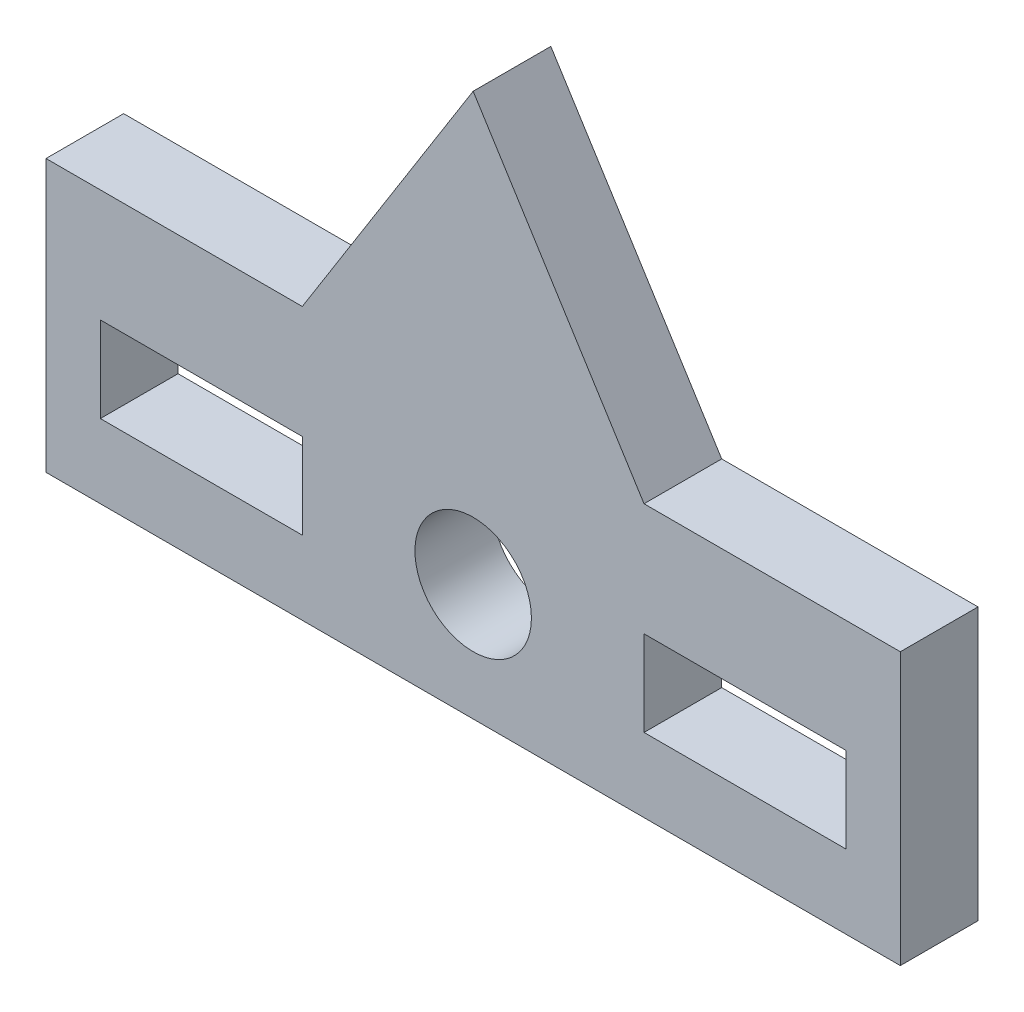
from build123d import *

# Parameters (mm, degrees)
SKETCH_1_R      = 1.5
SKETCH_1_W      = 5.2
SKETCH_1_H      = 2.2
EXTRUDE_1_DEPTH = 2


with BuildPart() as part:
    # 草图1 → 凸台-拉伸1 (new body)
    with BuildSketch(Plane.XY):
        Polygon((-11, 0), (-11, -3), (11, -3), (11, 0), (11, 4), (4.4, 4), (0, 11), (-4.4, 4), (-11, 4), align=None)
        Circle(SKETCH_1_R, mode=Mode.SUBTRACT)
        with Locations((7, 0)):
            Rectangle(SKETCH_1_W, SKETCH_1_H, mode=Mode.SUBTRACT)
        with Locations((-7, 0)):
            Rectangle(SKETCH_1_W, SKETCH_1_H, mode=Mode.SUBTRACT)
    extrude(amount=EXTRUDE_1_DEPTH)


solid = part.part
